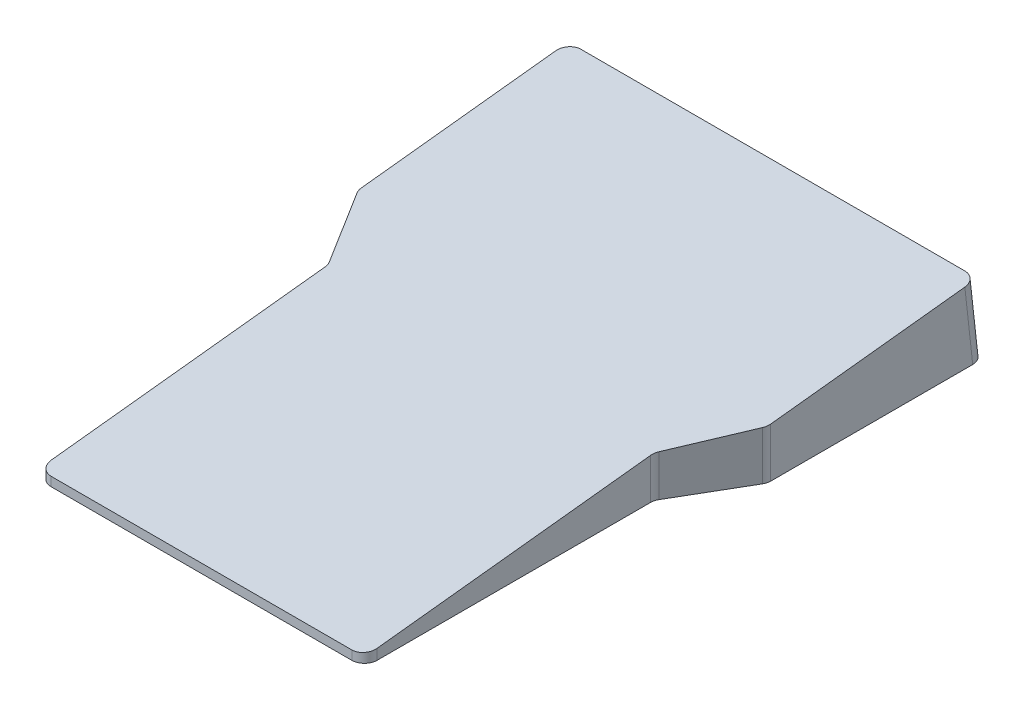
from build123d import *

# Parameters (mm, degrees)
BOSS_EXTRUDE1_DEPTH = 20
SKETCH2_R           = 2.4
SKETCH2_R_2         = 2.35
BOSS_EXTRUDE2_DEPTH = 3
CUT_EXTRUDE1_DEPTH  = 158.718007744
FILLET1_R           = 3.5


with BuildPart() as part:
    # Sketch1 → Boss-Extrude1 (new body)
    with BuildSketch(Plane(origin=(0, 0, 0), x_dir=(1, 0, 0), z_dir=(0, 1, 0))):
        Polygon((-57.597316241, 51.805869074), (-57.597316241, -8.444130926), (-46.097316241, -28.194130926), (-46.097316241, -108.194130926), (43.902683759, -108.194130926), (43.902683759, -28.194130926), (55.402683759, -8.444130926), (55.402683759, 51.805869074), align=None)
    extrude(amount=BOSS_EXTRUDE1_DEPTH)

    # Sketch2 → Boss-Extrude2 (add)
    with BuildSketch(Plane.XZ):
        with Locations(Location((-51.097316241, -45.305869074, 0), (0, 0, 90))):
            Circle(SKETCH2_R)
        with Locations(Location((48.902683759, -45.305869074, 0), (0, 0, 90))):
            Circle(SKETCH2_R)
        with Locations(Location((47.402683759, 6.944130926, 0), (0, 0, 90))):
            Circle(SKETCH2_R_2)
        with Locations(Location((-49.597316241, 6.944130926, 0), (0, 0, 90))):
            Circle(SKETCH2_R_2)
    extrude(amount=BOSS_EXTRUDE2_DEPTH)

    # Sketch3 → Cut-Extrude1 (cut, through all)
    with BuildSketch(Plane(origin=(55.402683759, 0, 0), x_dir=(0, 0, -1), z_dir=(1, 0, 0))):
        Polygon((-108.194130926, 20), (-108.194130926, 2.5), (-8.444130926, 13.563542172), (-8.444130926, 20), align=None)
        Polygon((-8.444130926, 20), (-8.444130926, 13.563542172), (49.587615005, 20), align=None)
        Polygon((49.587615005, 20), (51.805869074, 0), (51.805869074, 20), align=None)
    extrude(amount=-CUT_EXTRUDE1_DEPTH, mode=Mode.SUBTRACT)

    # Fillet1
    fillet1_edges = [part.edges().sort_by_distance(p)[0] for p in [
        (-57.597316241, 10, -50.69674204),
        (55.402683759, 10, -50.69674204),
        (-46.097316241, 5.686508139, 28.194130926),
        (-57.597316241, 6.781771086, 8.444130926),
        (43.902683759, 5.686508139, 28.194130926),
        (43.902683759, 1.25, 108.194130926),
        (-46.097316241, 1.25, 108.194130926),
        (55.402683759, 6.781771086, 8.444130926),
    ]]
    fillet(fillet1_edges, radius=FILLET1_R)


solid = part.part
